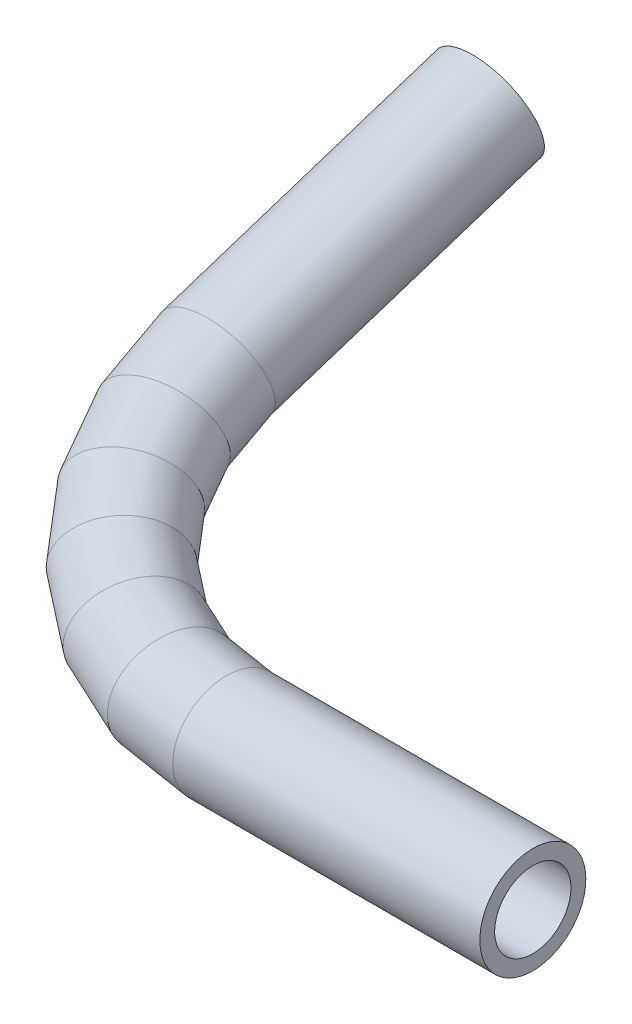
from build123d import *

# Parameters (mm, degrees)
PROFILE_R   = 3.175
PROFILE_R_2 = 2.286


with BuildPart() as part:
    # Tube: sweep along a curve in space
    with BuildLine() as tube_path:
        Line((-2754.892778381, 10.197560814, -31.384865038), (-2773.092778381, 10.197560814, -31.384865038))
        Line((-2773.092778381, 10.197560814, -31.384865038), (-2776.975064057, 10.355503296, -31.870962012))
        Line((-2776.975064057, 10.355503296, -31.870962012), (-2780.592778381, 10.81856722, -33.296126229))
        Line((-2780.592778381, 10.81856722, -33.296126229), (-2783.699380099, 11.555195547, -35.563235103))
        Line((-2783.699380099, 11.555195547, -35.563235103), (-2786.083159438, 12.515188272, -38.51778891))
        Line((-2786.083159438, 12.515188272, -38.51778891), (-2787.581665775, 13.633123479, -41.958439691))
        Line((-2787.581665775, 13.633123479, -41.958439691), (-2788.092778381, 14.83281573, -45.650712782))
        Line((-2788.092778381, 14.83281573, -45.650712782), (-2788.092778381, 20.132457184, -61.961332037))
    # Profile → Tube (sweep)
    with BuildSketch(Plane(origin=(-2754.892778381, 0, 0), x_dir=(0, 0, -1), z_dir=(1, 0, 0))):
        with Locations((31.384865038, 10.197560814)):
            Circle(PROFILE_R)
        with Locations((31.384865038, 10.197560814)):
            Circle(PROFILE_R_2, mode=Mode.SUBTRACT)
    sweep(path=tube_path.line, transition=Transition.RIGHT)


solid = part.part
